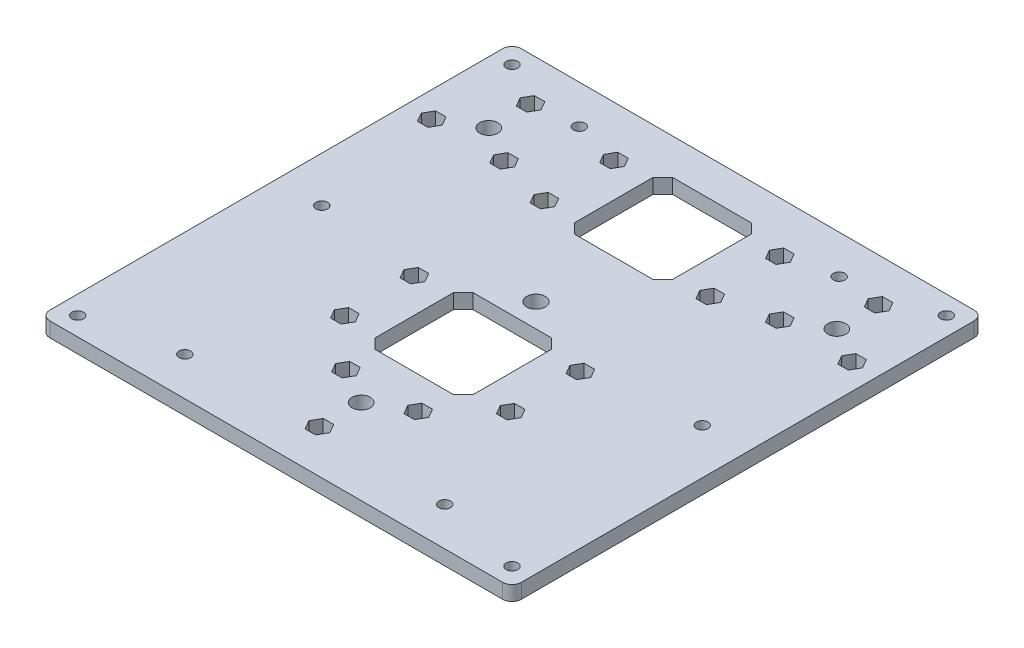
from build123d import *

# Parameters (mm, degrees)
ESQUISSE1_W               = 203.2
ESQUISSE1_H               = 203.2
BOSS_EXTRU_1_DEPTH        = 6.35
ESQUISSE2_R               = 3.925
ENL_V_MAT_EXTRU_1_DEPTH   = 144.824345992
ENL_V_MAT_EXTRU_2_DEPTH   = 144.824345992
ENL_V_MAT_EXTRU_5_DEPTH   = 144.824345992
ENL_V_MAT_EXTRU_6_DEPTH   = 144.824345992
ENL_V_MAT_EXTRU_7_DEPTH   = 144.824345992
ENL_V_MAT_EXTRU_8_DEPTH   = 144.824345992
ENL_V_MAT_EXTRU_9_DEPTH   = 144.824345992
ESQUISSE11_R              = 2.5
ENL_V_MAT_EXTRU_10_DEPTH  = 144.824345992
ESQUISSE12_R              = 4
ENL_V_MAT_EXTRU_11_DEPTH  = 144.824345992
ESQUISSE13_R              = 2.5
ENL_V_MAT_EXTRU_12_DEPTH  = 144.824345992
SYM_TRIE2_COPY_1_SKETCH_R = 2.5
SYM_TRIE2_COPY_1_DEPTH    = 144.824345992
CONG_3_R                  = 4
ENL_V_MAT_EXTRU_13_DEPTH  = 144.824345992
ESQUISSE15_R              = 2.6
ENL_V_MAT_EXTRU_14_DEPTH  = 144.824345992
ENL_V_MAT_EXTRU_15_DEPTH  = 144.824345992


with BuildPart() as part:
    # Esquisse1 → Boss.-Extru.1 (new body)
    with BuildSketch(Plane(origin=(0, 0, 0), x_dir=(1, 0, 0), z_dir=(0, 1, 0))):
        Rectangle(ESQUISSE1_W, ESQUISSE1_H)
    extrude(amount=BOSS_EXTRU_1_DEPTH)

    # Esquisse2 → Enlèv. mat.-Extru.1 (cut, through all)
    with BuildSketch(Plane(origin=(0, 6.35, 0), x_dir=(1, 0, 0), z_dir=(0, 1, 0))):
        with Locations(Location((-75, 65, 0), (0, 0, 270))):
            Circle(ESQUISSE2_R)
        with Locations(Location((75, 65, 0), (0, 0, 270))):
            Circle(ESQUISSE2_R)
        with Locations(Location((0, -65, 0), (0, 0, 270))):
            Circle(ESQUISSE2_R)
    extrude(amount=-ENL_V_MAT_EXTRU_1_DEPTH, mode=Mode.SUBTRACT)

    # Esquisse3 → Enlèv. mat.-Extru.2 (cut, through all)
    with BuildSketch(Plane(origin=(0, 6.35, 0), x_dir=(1, 0, 0), z_dir=(0, 1, 0))):
        Polygon((-16.978069991, 86.15), (-21.15, 81.978069991), (-21.15, 48.021930009), (-16.978069991, 43.85), (16.978069991, 43.85), (21.15, 48.021930009), (21.15, 81.978069991), (16.978069991, 86.15), align=None)
    extrude(amount=-ENL_V_MAT_EXTRU_2_DEPTH, mode=Mode.SUBTRACT)

    # Esquisse5 → Enlèv. mat.-Extru.5 (cut, through all)
    with BuildSketch(Plane(origin=(0, 6.35, 0), x_dir=(1, 0, 0), z_dir=(0, 1, 0))):
        Polygon((-31.3966679, 49.85), (-33.64833395, 45.95), (-38.15166605, 45.95), (-40.4033321, 49.85), (-38.15166605, 53.75), (-33.64833395, 53.75), align=None)
    extrude(amount=-ENL_V_MAT_EXTRU_5_DEPTH, mode=Mode.SUBTRACT)

    # Esquisse7 → Enlèv. mat.-Extru.6 (cut, through all)
    with BuildSketch(Plane(origin=(0, 6.35, 0), x_dir=(1, 0, 0), z_dir=(0, 1, 0))):
        Polygon((-33.64833395, 75.95), (-38.15166605, 75.95), (-40.4033321, 79.85), (-38.15166605, 83.75), (-33.64833395, 83.75), (-31.3966679, 79.85), align=None)
    extrude(amount=-ENL_V_MAT_EXTRU_6_DEPTH, mode=Mode.SUBTRACT)

    # Esquisse8 → Enlèv. mat.-Extru.7 (cut, through all)
    with BuildSketch(Plane(origin=(0, 6.35, 0), x_dir=(1, 0, 0), z_dir=(0, 1, 0))):
        Polygon((37.85166605, 45.95), (33.34833395, 45.95), (31.0966679, 49.85), (33.34833395, 53.75), (37.85166605, 53.75), (40.1033321, 49.85), align=None)
    extrude(amount=-ENL_V_MAT_EXTRU_7_DEPTH, mode=Mode.SUBTRACT)

    # Esquisse9 → Enlèv. mat.-Extru.8 (cut, through all)
    with BuildSketch(Plane(origin=(0, 6.35, 0), x_dir=(1, 0, 0), z_dir=(0, 1, 0))):
        Polygon((37.85166605, 75.95), (33.34833395, 75.95), (31.0966679, 79.85), (33.34833395, 83.75), (37.85166605, 83.75), (40.1033321, 79.85), align=None)
    extrude(amount=-ENL_V_MAT_EXTRU_8_DEPTH, mode=Mode.SUBTRACT)

    # Esquisse10 → Enlèv. mat.-Extru.9 (cut, through all)
    with BuildSketch(Plane(origin=(0, 6.35, 0), x_dir=(1, 0, 0), z_dir=(0, 1, 0))):
        Polygon((-11.085125168, -56), (-13.336791218, -52.1), (-17.840123318, -52.1), (-20.091789368, -56), (-17.840123318, -59.9), (-13.336791218, -59.9), align=None)
        Polygon((11.085125168, -56), (13.336791218, -59.9), (17.840123318, -59.9), (20.091789368, -56), (17.840123318, -52.1), (13.336791218, -52.1), align=None)
        Polygon((-4.5033321, -83), (-2.25166605, -86.9), (2.25166605, -86.9), (4.5033321, -83), (2.25166605, -79.1), (-2.25166605, -79.1), align=None)
        Polygon((-63.916340686, 55.999154304), (-61.664674636, 52.099154304), (-57.161342537, 52.099154304), (-54.909676487, 55.999154304), (-57.161342537, 59.899154304), (-61.664674636, 59.899154304), align=None)
        Polygon((-95.093255222, 55.999154304), (-92.841589173, 52.099154304), (-88.338257073, 52.099154304), (-86.086591023, 55.999154304), (-88.338257073, 59.899154304), (-92.841589173, 59.899154304), align=None)
        Polygon((-79.504797954, 82.999154304), (-77.253131904, 79.099154304), (-72.749799805, 79.099154304), (-70.498133755, 82.999154304), (-72.749799805, 86.899154304), (-77.253131904, 86.899154304), align=None)
        Polygon((54.908210632, 56), (57.159876682, 52.1), (61.663208782, 52.1), (63.914874832, 56), (61.663208782, 59.9), (57.159876682, 59.9), align=None)
        Polygon((95.091789368, 56), (92.840123318, 59.9), (88.336791218, 59.9), (86.085125168, 56), (88.336791218, 52.1), (92.840123318, 52.1), align=None)
        Polygon((70.4966679, 83), (72.74833395, 79.1), (77.25166605, 79.1), (79.5033321, 83), (77.25166605, 86.9), (72.74833395, 86.9), align=None)
    extrude(amount=-ENL_V_MAT_EXTRU_9_DEPTH, mode=Mode.SUBTRACT)

    # Esquisse11 → Enlèv. mat.-Extru.10 (cut, through all)
    with BuildSketch(Plane(origin=(0, 6.35, 0), x_dir=(1, 0, 0), z_dir=(0, 1, 0))):
        with Locations(Location((93.6, 93.6, 0), (0, 0, 270))):
            Circle(ESQUISSE11_R)
        with Locations(Location((-93.6, 93.6, 0), (0, 0, 270))):
            Circle(ESQUISSE11_R)
        with Locations(Location((-93.6, -93.6, 0), (0, 0, 270))):
            Circle(ESQUISSE11_R)
        with Locations(Location((93.6, -93.6, 0), (0, 0, 270))):
            Circle(ESQUISSE11_R)
    extrude(amount=-ENL_V_MAT_EXTRU_10_DEPTH, mode=Mode.SUBTRACT)

    # Esquisse12 → Enlèv. mat.-Extru.11 (cut, through all)
    with BuildSketch(Plane(origin=(0, 6.35, 0), x_dir=(1, 0, 0), z_dir=(0, 1, 0))):
        with Locations(Location((0, 10.325, 0), (0, 0, 270))):
            Circle(ESQUISSE12_R)
    extrude(amount=-ENL_V_MAT_EXTRU_11_DEPTH, mode=Mode.SUBTRACT)

    # Esquisse13 → Enlèv. mat.-Extru.12 (cut, through all)
    with BuildSketch(Plane.XZ):
        with Locations(Location((56, -85, 0), (0, 0, 270))):
            Circle(ESQUISSE13_R)
        with Locations(Location((82, 0, 0), (0, 0, 270))):
            Circle(ESQUISSE13_R)
    enl_v_mat_extru_12 = extrude(amount=-ENL_V_MAT_EXTRU_12_DEPTH, mode=Mode.SUBTRACT)

    # Symétrie1: Enlèv. mat.-Extru.12 across plane
    add(enl_v_mat_extru_12.mirror(Plane.XY), mode=Mode.SUBTRACT)

    # Symétrie2: Enlèv. mat.-Extru.12 across plane
    add(enl_v_mat_extru_12.mirror(Plane(origin=(0, 0, 0), x_dir=(0, 0, 1), z_dir=(1, 0, 0))), mode=Mode.SUBTRACT)

    # Symétrie2 copy 1 sketch → Symétrie2 copy 1 (cut, through all)
    with BuildSketch(Plane(origin=(0, 0, 0), x_dir=(-1, 0, 0), z_dir=(0, -1, 0))):
        with Locations(Location((56, -85, 0), (0, 0, 270))):
            Circle(SYM_TRIE2_COPY_1_SKETCH_R)
        with Locations(Location((82, 0, 0), (0, 0, 270))):
            Circle(SYM_TRIE2_COPY_1_SKETCH_R)
    extrude(amount=-SYM_TRIE2_COPY_1_DEPTH, mode=Mode.SUBTRACT)

    # Congé3
    cong_3_edges = [part.edges().sort_by_distance(p)[0] for p in [
        (101.6, 3.175, 101.6),
        (-101.6, 3.175, 101.6),
        (-101.6, 3.175, -101.6),
        (101.6, 3.175, -101.6),
    ]]
    fillet(cong_3_edges, radius=CONG_3_R)

    # Esquisse14 → Enlèv. mat.-Extru.13 (cut, through all)
    with BuildSketch(Plane(origin=(0, 6.35, 0), x_dir=(1, 0, 0), z_dir=(0, 1, 0))):
        Polygon((16.978069991, -42.150000003), (-16.978069991, -42.150000003), (-21.15, -37.978069994), (-21.15, -4.021930012), (-16.978069991, 0.149999997), (16.978069991, 0.149999997), (21.15, -4.021930012), (21.15, -37.978069994), align=None)
    extrude(amount=-ENL_V_MAT_EXTRU_13_DEPTH, mode=Mode.SUBTRACT)

    # Esquisse15 → Enlèv. mat.-Extru.14 (cut, through all)
    with BuildSketch(Plane(origin=(0, 6.35, 0), x_dir=(1, 0, 0), z_dir=(0, 1, 0))):
        with Locations(Location((35.6, -36.15, 0), (0, 0, 270))):
            Circle(ESQUISSE15_R)
        with Locations(Location((35.6, -6.15, 0), (0, 0, 270))):
            Circle(ESQUISSE15_R)
        with Locations(Location((-35.9, -36.15, 0), (0, 0, 270))):
            Circle(ESQUISSE15_R)
        with Locations(Location((-35.9, -6.15, 0), (0, 0, 270))):
            Circle(ESQUISSE15_R)
    extrude(amount=-ENL_V_MAT_EXTRU_14_DEPTH, mode=Mode.SUBTRACT)

    # Esquisse16 → Enlèv. mat.-Extru.15 (cut, through all)
    with BuildSketch(Plane(origin=(0, 6.35, 0), x_dir=(1, 0, 0), z_dir=(0, 1, 0))):
        Polygon((31.0966679, -36.15), (33.34833395, -40.05), (37.85166605, -40.05), (40.1033321, -36.15), (37.85166605, -32.25), (33.34833395, -32.25), align=None)
        Polygon((31.0966679, -6.15), (33.34833395, -10.05), (37.85166605, -10.05), (40.1033321, -6.15), (37.85166605, -2.25), (33.34833395, -2.25), align=None)
        Polygon((-40.4033321, -6.15), (-38.15166605, -10.05), (-33.64833395, -10.05), (-31.3966679, -6.15), (-33.64833395, -2.25), (-38.15166605, -2.25), align=None)
        Polygon((-40.4033321, -36.15), (-38.15166605, -40.05), (-33.64833395, -40.05), (-31.3966679, -36.15), (-33.64833395, -32.25), (-38.15166605, -32.25), align=None)
    extrude(amount=-ENL_V_MAT_EXTRU_15_DEPTH, mode=Mode.SUBTRACT)


solid = part.part
